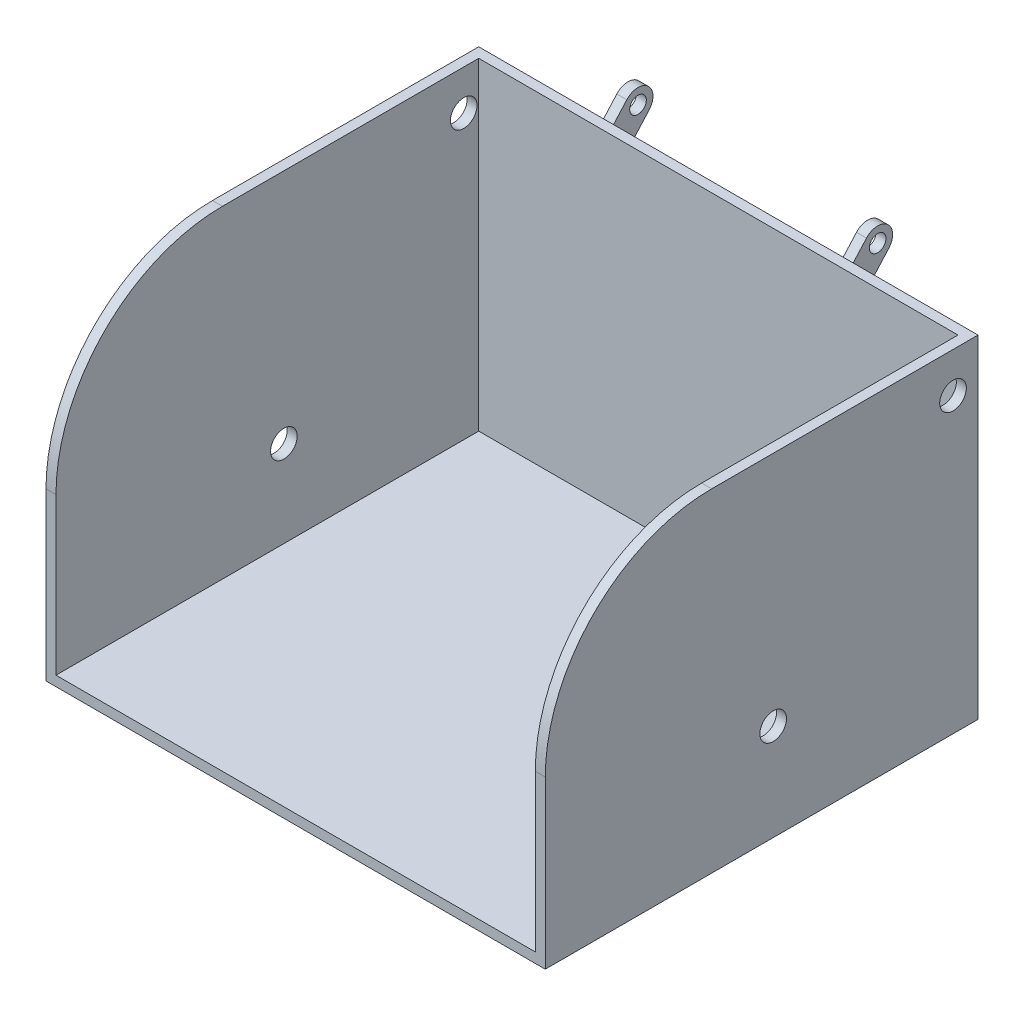
from build123d import *

# Parameters (mm, degrees)
BOSS_EXTRUDE1_DEPTH = 150
SKETCH2_W           = 144
SKETCH2_H           = 132
CUT_EXTRUDE1_DEPTH  = 97
SKETCH3_R           = 2.5
BOSS_EXTRUDE2_DEPTH = 1.5
CUT_EXTRUDE2_REACH  = 227.015
SKETCH4_R           = 4


with BuildPart() as part:
    # Sketch1 → Boss-Extrude1 (new body)
    with BuildSketch(Plane(origin=(0, 0, 0), x_dir=(0, 0, -1), z_dir=(1, 0, 0))):
        with BuildLine():
            Line((0, 0), (-130, 0))
            Line((-130, 0), (-130, 50))
            ThreePointArc((-130, 50), (-115.355339059, 85.355339059), (-80, 100))
            Line((-80, 100), (0, 100))
            Line((0, 100), (0, 0))
        make_face()
    extrude(amount=BOSS_EXTRUDE1_DEPTH)

    # Sketch2 → Cut-Extrude1 (cut)
    with BuildSketch(Plane(origin=(0, 100, 0), x_dir=(1, 0, 0), z_dir=(0, 1, 0))):
        with Locations((75, -69)):
            Rectangle(SKETCH2_W, SKETCH2_H)
    extrude(amount=-CUT_EXTRUDE1_DEPTH, mode=Mode.SUBTRACT)

    # Sketch3 → Boss-Extrude2 (add, symmetric)
    with BuildSketch(Plane(origin=(111, 0, 0), x_dir=(0, 0, -1), z_dir=(1, 0, 0))):
        with BuildLine():
            Line((0, 100), (0, 86.483689179))
            Line((0, 86.483689179), (10.709846007, 98.483689179))
            ThreePointArc((10.709846007, 98.483689179), (10.348889249, 104.837405432), (3.995172996, 104.476448674))
            Line((3.995172996, 104.476448674), (0, 100))
        make_face()
        with Locations((7.352509502, 101.480068927)):
            Circle(SKETCH3_R, mode=Mode.SUBTRACT)
    boss_extrude2 = extrude(amount=BOSS_EXTRUDE2_DEPTH, both=True)

    # Mirror1: Boss-Extrude2 across plane
    add(boss_extrude2.mirror(Plane(origin=(75, 0, 0), x_dir=(0, 0, 1), z_dir=(1, 0, 0))))

    # Sketch4 → Cut-Extrude2 (cut, up to next)
    with BuildSketch(Plane(origin=(150, 0, 0), x_dir=(0, 0, -1), z_dir=(1, 0, 0)), mode=Mode.PRIVATE) as cut_extrude2_sk1:
        with Locations((-61.531516432, 29)):
            Circle(SKETCH4_R)
    cut_extrude2_tool1 = extrude(cut_extrude2_sk1.sketch, amount=-CUT_EXTRUDE2_REACH, mode=Mode.PRIVATE) & part.part
    # Sketch4 → Cut-Extrude2 (cut, up to next)
    with BuildSketch(Plane(origin=(150, 0, 0), x_dir=(0, 0, -1), z_dir=(1, 0, 0)), mode=Mode.PRIVATE) as cut_extrude2_sk2:
        with Locations((-7.503745795, 88)):
            Circle(SKETCH4_R)
    cut_extrude2_tool2 = extrude(cut_extrude2_sk2.sketch, amount=-CUT_EXTRUDE2_REACH, mode=Mode.PRIVATE) & part.part
    cut_extrude2_1 = cut_extrude2_tool1.solids().sort_by_distance((150, 29, 61.531516))[0]
    add(cut_extrude2_1, mode=Mode.SUBTRACT)
    cut_extrude2_2 = cut_extrude2_tool2.solids().sort_by_distance((150, 88, 7.503746))[0]
    add(cut_extrude2_2, mode=Mode.SUBTRACT)
    cut_extrude2 = cut_extrude2_1 + cut_extrude2_2  # Cut-Extrude2 as one shape, for the pattern or mirror that repeats it

    # Mirror2: Cut-Extrude2 across plane
    add(cut_extrude2.mirror(Plane(origin=(75, 0, 0), x_dir=(0, 0, 1), z_dir=(1, 0, 0))), mode=Mode.SUBTRACT)


solid = part.part
